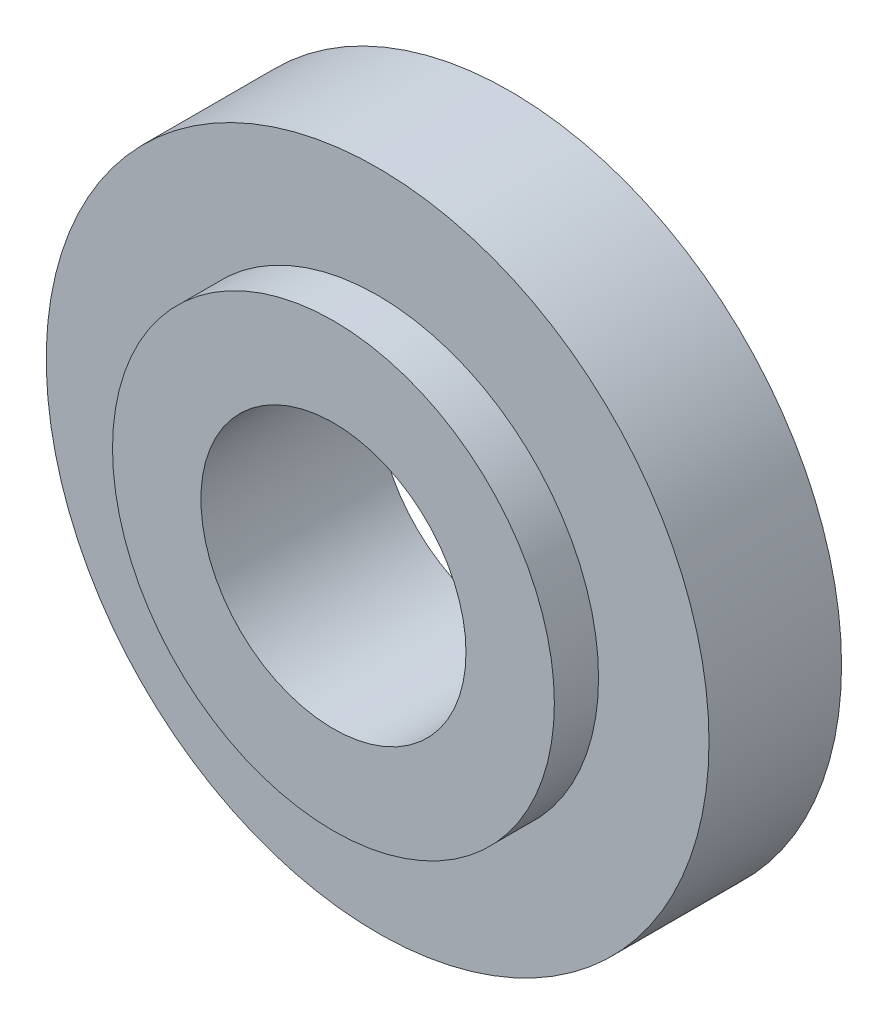
from build123d import *

# Parameters (mm, degrees)
SKETCH1_R           = 3.75
SKETCH1_R_2         = 2.5
SKETCH1_R_3         = 1.5
BOSS_EXTRUDE1_DEPTH = 1.5
SKETCH2_R           = 2.5
SKETCH2_R_2         = 1.5
BOSS_EXTRUDE2_DEPTH = 0.5


with BuildPart() as part:
    # Sketch1 → Boss-Extrude1 (new body)
    # profile 1 of 2: a face of its own
    with BuildSketch(Plane.XY):
        Circle(SKETCH1_R)
        Circle(SKETCH1_R_2, mode=Mode.SUBTRACT)
    # profile 2 of 2: a face of its own
    with BuildSketch(Plane.XY):
        Circle(SKETCH1_R_2)
        Circle(SKETCH1_R_3, mode=Mode.SUBTRACT)
    extrude(amount=BOSS_EXTRUDE1_DEPTH)

    # Sketch2 → Boss-Extrude2 (add)
    with BuildSketch(Plane.XY.offset(1.5)):
        Circle(SKETCH2_R)
        Circle(SKETCH2_R_2, mode=Mode.SUBTRACT)
    extrude(amount=BOSS_EXTRUDE2_DEPTH)


solid = part.part
